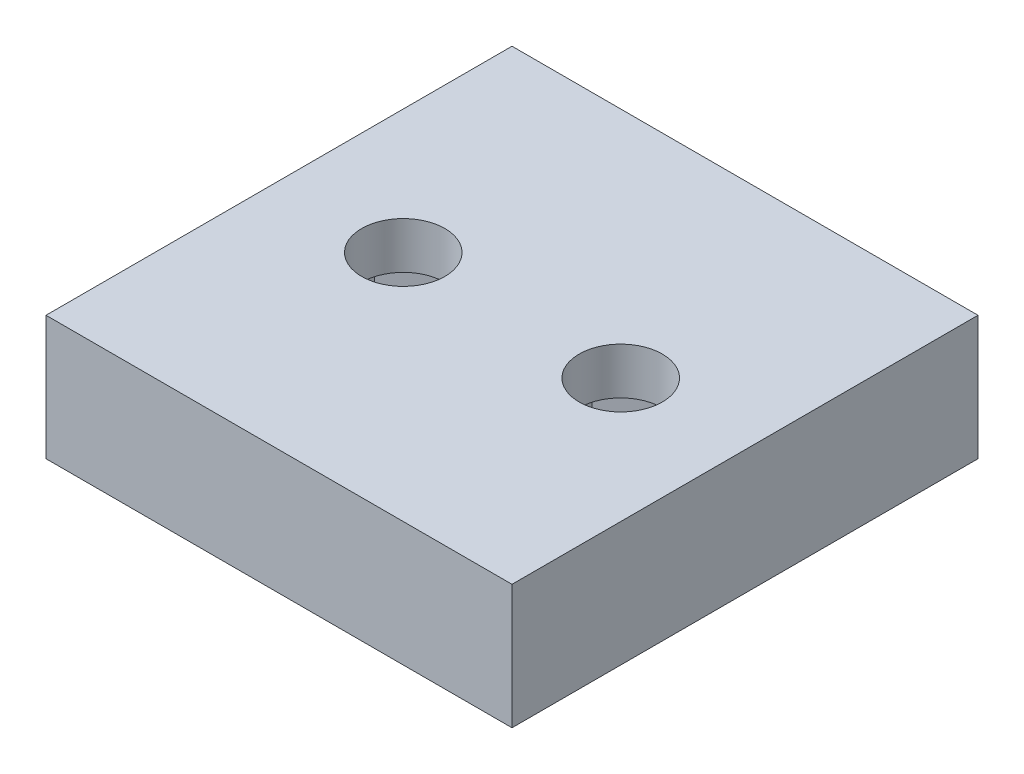
from build123d import *

# Parameters (mm, degrees)
SKETCH1_W            = 19.05
SKETCH1_H            = 19.05
BOSS_EXTRUDE1_DEPTH  = 5.08
M3_CLEARANCE_HOLE1_D = 3.4
CUT_EXTRUDE2_DEPTH   = 3.175


with BuildPart() as part:
    # Sketch1 → Boss-Extrude1 (new body)
    with BuildSketch(Plane(origin=(0, 0, 0), x_dir=(1, 0, 0), z_dir=(0, 1, 0))):
        Rectangle(SKETCH1_W, SKETCH1_H)
    extrude(amount=BOSS_EXTRUDE1_DEPTH)

    # M3 Clearance Hole1 (through all)
    with Locations(Plane(origin=(0, 0, 0), x_dir=(-1, 0, 0), z_dir=(0, -1, 0))):
        with Locations((-4.445, 0), (4.445, 0)):
            Hole(M3_CLEARANCE_HOLE1_D / 2)

    # Sketch8 → Cut-Extrude2 (cut)
    with BuildSketch(Plane.XZ):
        Polygon((-7.239, -1.613116652), (-4.445, -3.226233304), (-1.651, -1.613116652), (-1.651, 1.613116652), (-4.445, 3.226233304), (-7.239, 1.613116652), align=None)
        Polygon((7.239, -1.613116652), (7.239, 1.613116652), (4.445, 3.226233304), (1.651, 1.613116652), (1.651, -1.613116652), (4.445, -3.226233304), align=None)
    extrude(amount=-CUT_EXTRUDE2_DEPTH, mode=Mode.SUBTRACT)


solid = part.part
